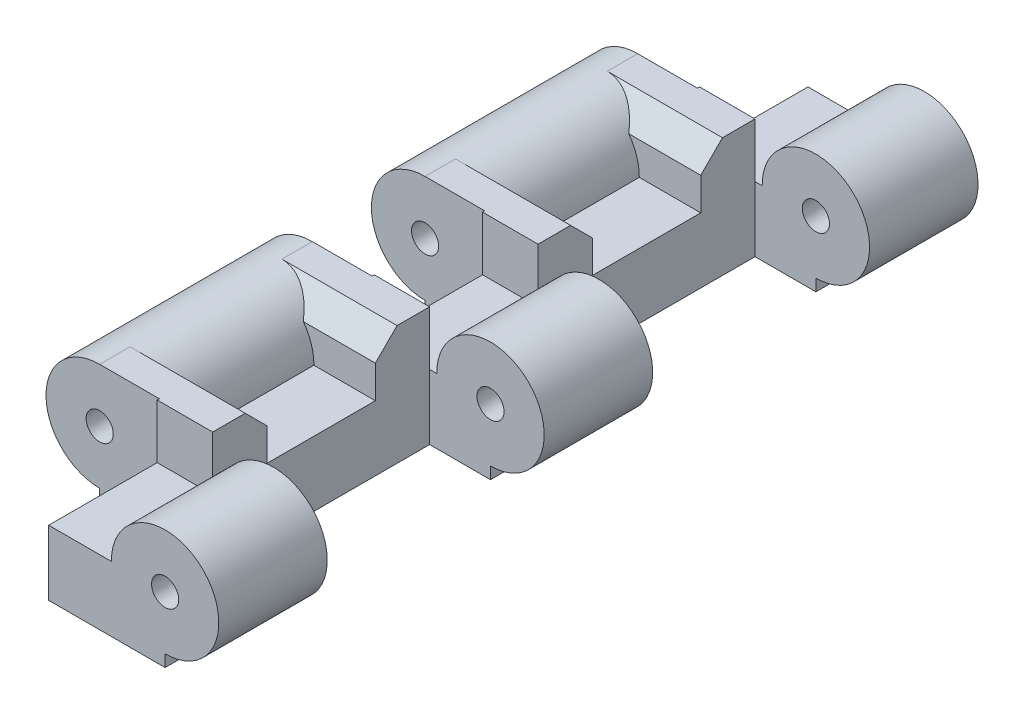
from build123d import *

# Parameters (mm, degrees)
SKETCH1_W             = 10.6165
SKETCH1_H             = 20
SKETCH1_W_2           = 10.732
SKETCH1_H_2           = 10
BOSS_EXTRUDE1_DEPTH   = 6
SKETCH2_W             = 10.6165
SKETCH2_H             = 5
BOSS_EXTRUDE2_DEPTH   = 5
CHAMFER1_SIZE         = 2
BOSS_EXTRUDE3_START   = -10
SKETCH3_R             = 4.95
BOSS_EXTRUDE3_DEPTH   = 20
BOSS_EXTRUDE4_START   = 10
SKETCH3_3_R           = 4.95
BOSS_EXTRUDE4_DEPTH   = 10
BOSS_EXTRUDE5_START   = -20
SKETCH3_4_R           = 4.95
BOSS_EXTRUDE5_DEPTH   = 10
BOSS_EXTRUDE6_START   = -40
SKETCH3_5_R           = 4.95
BOSS_EXTRUDE6_DEPTH   = 20
BOSS_EXTRUDE7_START   = -50
SKETCH3_6_R           = 4.95
BOSS_EXTRUDE7_DEPTH   = 10
F_1_0MM_DOWEL_HOLE1_D = 2.5
CUT_EXTRUDE1_START    = -0.2
CUT_EXTRUDE1_DEPTH    = 0.2
CUT_EXTRUDE2_START    = -30.2
CUT_EXTRUDE2_DEPTH    = 10.4
CUT_EXTRUDE3_START    = -50
CUT_EXTRUDE3_DEPTH    = 0.2


with BuildPart() as part:
    # Sketch1 → Boss-Extrude1 (new body)
    with BuildSketch(Plane(origin=(0, 0, 0), x_dir=(1, 0, 0), z_dir=(0, 1, 0))):
        Polygon((16.2325, -10), (10.6165, -10), (5.5005, -10), (5.5005, -20), (16.2325, -20), align=None)
        Polygon((10.6165, 0), (0, 0), (0, -10), (5.5005, -10), (10.6165, -10), align=None)
        Polygon((0, 10), (0, 0), (10.6165, 0), (10.6165, 10), (5.5005, 10), align=None)
        Polygon((5.5005, 10), (10.6165, 10), (16.2325, 10), (16.2325, 20), (10.6165, 20), (5.5005, 20), align=None)
        with Locations((5.30825, 30)):
            Rectangle(SKETCH1_W, SKETCH1_H)
        with Locations((10.8665, 45)):
            Rectangle(SKETCH1_W_2, SKETCH1_H_2)
    extrude(amount=BOSS_EXTRUDE1_DEPTH)

    # Sketch2 → Boss-Extrude2 (add)
    with BuildSketch(Plane(origin=(0, 6, 0), x_dir=(1, 0, 0), z_dir=(0, 1, 0))):
        with Locations((5.30825, 7.5)):
            Rectangle(SKETCH2_W, SKETCH2_H)
        with Locations((5.30825, -7.5)):
            Rectangle(SKETCH2_W, SKETCH2_H)
        with Locations((5.30825, 37.5)):
            Rectangle(SKETCH2_W, SKETCH2_H)
        with Locations((5.30825, 22.5)):
            Rectangle(SKETCH2_W, SKETCH2_H)
    extrude(amount=BOSS_EXTRUDE2_DEPTH)

    # Chamfer1
    chamfer1_edges = [part.edges().sort_by_distance(p)[0] for p in [
        (5.30825, 11, -35),
        (5.30825, 11, -25),
        (5.30825, 11, -5),
        (5.30825, 11, 5),
    ]]
    chamfer(chamfer1_edges, length=CHAMFER1_SIZE)

    # Sketch3 → Boss-Extrude3 (add)
    with BuildSketch(Plane.XY.offset(BOSS_EXTRUDE3_START)):
        with Locations((0, 6.05)):
            Circle(SKETCH3_R)
    extrude(amount=BOSS_EXTRUDE3_DEPTH)

    # Sketch3<3> → Boss-Extrude4 (add)
    with BuildSketch(Plane.XY.offset(BOSS_EXTRUDE4_START)):
        with Locations((16.2325, 6.05)):
            Circle(SKETCH3_3_R)
    extrude(amount=BOSS_EXTRUDE4_DEPTH)

    # Sketch3<4> → Boss-Extrude5 (add)
    with BuildSketch(Plane.XY.offset(BOSS_EXTRUDE5_START)):
        with Locations((16.2325, 6.05)):
            Circle(SKETCH3_4_R)
    extrude(amount=BOSS_EXTRUDE5_DEPTH)

    # Sketch3<5> → Boss-Extrude6 (add)
    with BuildSketch(Plane.XY.offset(BOSS_EXTRUDE6_START)):
        with Locations((0, 6.05)):
            Circle(SKETCH3_5_R)
    extrude(amount=BOSS_EXTRUDE6_DEPTH)

    # Sketch3<6> → Boss-Extrude7 (add)
    with BuildSketch(Plane.XY.offset(BOSS_EXTRUDE7_START)):
        with Locations((16.2325, 6.05)):
            Circle(SKETCH3_6_R)
    extrude(amount=BOSS_EXTRUDE7_DEPTH)

    # Ø1.0mm Dowel Hole1 (through all)
    with Locations(Plane.XY.offset(20)):
        with Locations((0, 6.05), (16.2325, 6.05)):
            Hole(F_1_0MM_DOWEL_HOLE1_D / 2)

    # Sketch9 → Cut-Extrude1 (cut)
    with BuildSketch(Plane.XY.offset(10).offset(CUT_EXTRUDE1_START)):
        with BuildLine():
            Line((5.5005, 6), (5.5005, 11))
            Line((5.5005, 11), (0, 11))
            ThreePointArc((0, 11), (-4.95, 6.05), (0, 1.1))
            Line((0, 1.1), (0, 0))
            Line((0, 0), (5.5005, 0))
            Line((5.5005, 0), (5.5005, 6))
        make_face()
    extrude(amount=CUT_EXTRUDE1_DEPTH, mode=Mode.SUBTRACT)

    # Sketch9<2> → Cut-Extrude2 (cut)
    with BuildSketch(Plane.XY.offset(10).offset(CUT_EXTRUDE2_START)):
        with BuildLine():
            Line((5.5005, 0), (5.5005, 6))
            Line((5.5005, 6), (5.5005, 11))
            Line((5.5005, 11), (0, 11))
            ThreePointArc((0, 11), (-4.95, 6.05), (0, 1.1))
            Line((0, 1.1), (0, 0))
            Line((0, 0), (5.5005, 0))
        make_face()
    extrude(amount=CUT_EXTRUDE2_DEPTH, mode=Mode.SUBTRACT)

    # Sketch9<4> → Cut-Extrude3 (cut)
    with BuildSketch(Plane.XY.offset(10).offset(CUT_EXTRUDE3_START)):
        with BuildLine():
            Line((5.5005, 0), (5.5005, 6))
            Line((5.5005, 6), (5.5005, 11))
            Line((5.5005, 11), (0, 11))
            ThreePointArc((0, 11), (-4.95, 6.05), (0, 1.1))
            Line((0, 1.1), (0, 0))
            Line((0, 0), (5.5005, 0))
        make_face()
    extrude(amount=CUT_EXTRUDE3_DEPTH, mode=Mode.SUBTRACT)


solid = part.part
